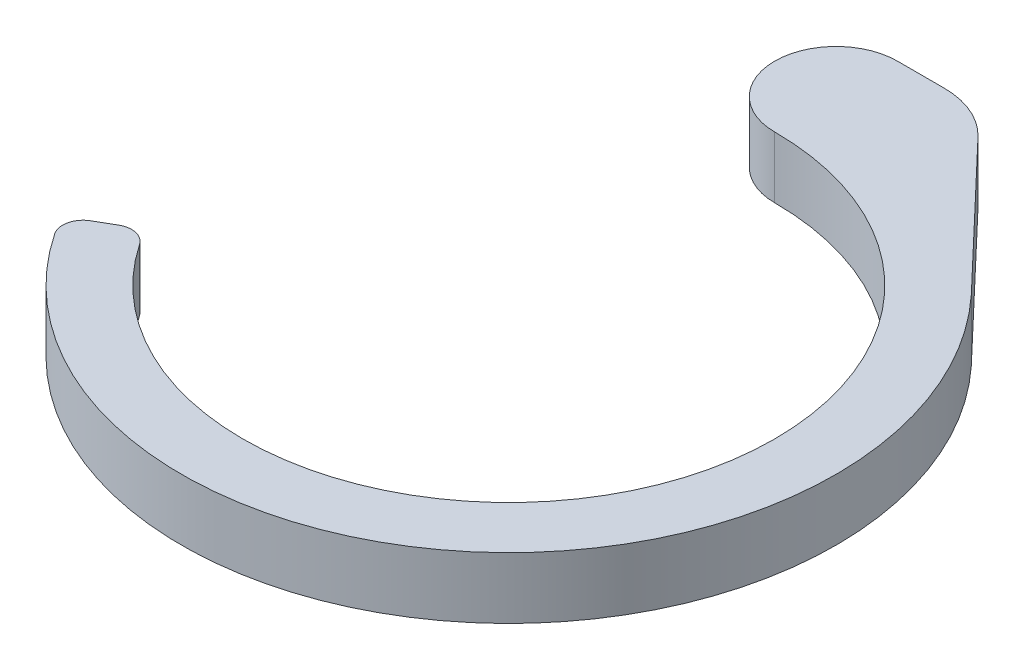
from build123d import *

# Parameters (mm, degrees)
EXTRUDE_4_DEPTH     = 15
SKETCH_3_R          = 10.1
CUT_EXTRUDE_1_DEPTH = 2


with BuildPart() as part:
    # ｽｹｯﾁ2 → ﾎﾞｽ - 押し出し4 (new body)
    with BuildSketch(Plane(origin=(0, 0, 0), x_dir=(1, 0, 0), z_dir=(0, 1, 0))):
        with BuildLine():
            ThreePointArc((-53.82643789, -36.437818048), (-56.846261527, -34.367935813), (-60.466933112, -34.910600109))
            Line((-60.466933112, -34.910600109), (-64.807406984, -37.416573868))
            ThreePointArc((-64.807406984, -37.416573868), (-67.177509772, -40.614402853), (-66.461234116, -44.529814279))
            ThreePointArc((-66.461234116, -44.529814279), (49.665387485, -62.716419588), (58.57572973, 54.487465409))
            Line((58.57572973, 54.487465409), (57.289371136, 55.838409315))
            Line((57.289371136, 55.838409315), (25.911523347, 88.791671712))
            ThreePointArc((25.911523347, 88.791671712), (19.306695871, 93.382511176), (11.427401304, 95))
            Line((11.427401304, 95), (0, 95))
            ThreePointArc((0, 95), (-15, 80), (0, 65))
            ThreePointArc((0, 65), (57.41714976, -30.467538684), (-53.82643789, -36.437818048))
        make_face()
    extrude(amount=EXTRUDE_4_DEPTH)

    # ｽｹｯﾁ3 → ｶｯﾄ - 押し出し1 (cut)
    with BuildSketch(Plane.XZ):
        with Locations(Location((0, -80, 0), (0, 0, 270))):
            Circle(SKETCH_3_R)
    extrude(amount=-CUT_EXTRUDE_1_DEPTH, mode=Mode.SUBTRACT)


solid = part.part
